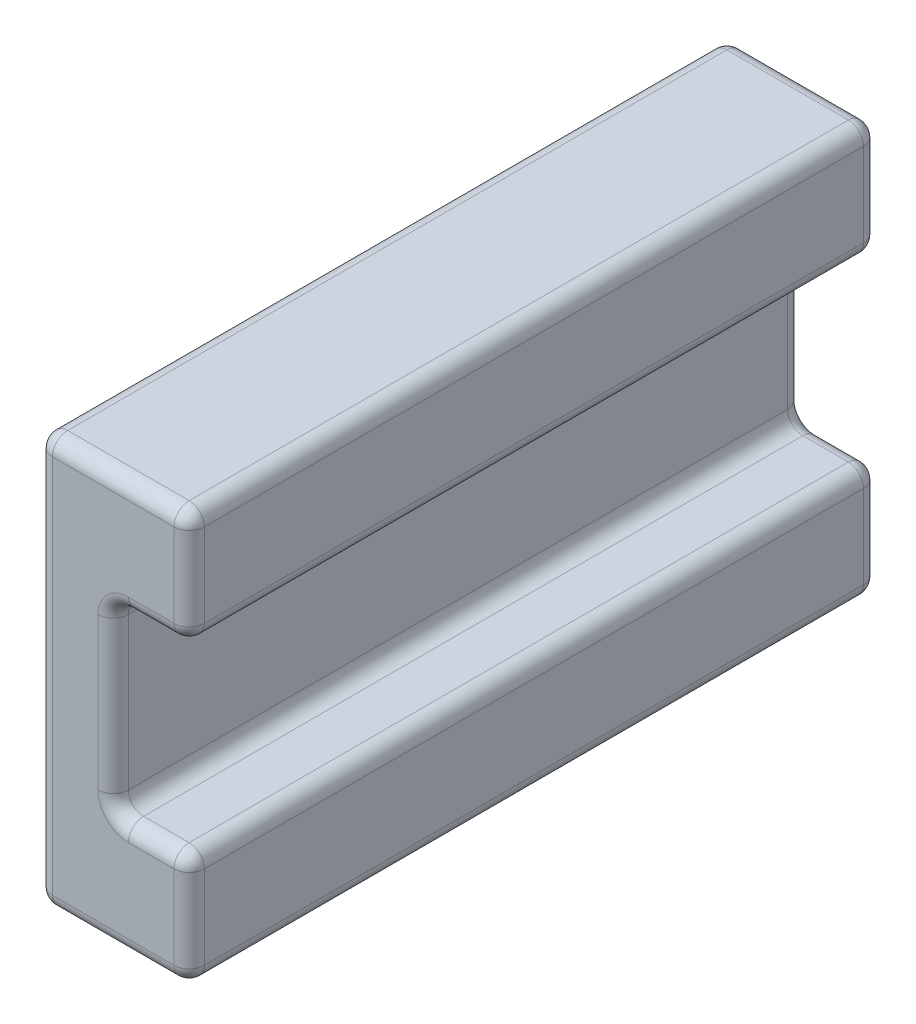
from build123d import *

# Parameters (mm, degrees)
BOSS_EXTRUDE1_DEPTH         = 45.4
FILLET1_R                   = 1
M3_TAPPED_HOLE2_D           = 2.5
M3_TAPPED_HOLE2_DEPTH       = 4.248924226
M3_TAPPED_HOLE2_CSINK_D     = 3.05
M3_TAPPED_HOLE2_CSINK_ANGLE = 90
M3_TAPPED_HOLE2_TIP         = 0.751075774


with BuildPart() as part:
    # Sketch1 → Boss-Extrude1 (new body)
    with BuildSketch(Plane.XY):
        Polygon((5, -6), (5, -13.5), (-5, -13.5), (-5, 13.5), (5, 13.5), (5, 6), (0, 6), (0, -6), align=None)
    extrude(amount=BOSS_EXTRUDE1_DEPTH)

    # Fillet1
    fillet1_edges = [part.edges().sort_by_distance(p)[0] for p in [
        (0, 0, 0),
        (2.5, -6, 0),
        (5, -9.75, 0),
        (0, -13.5, 0),
        (2.5, -6, 45.4),
        (-5, -13.5, 22.7),
        (-5, 13.5, 22.7),
        (5, 13.5, 22.7),
        (5, 6, 22.7),
        (0, 6, 22.7),
        (0, -6, 22.7),
        (5, -6, 22.7),
        (5, -13.5, 22.7),
        (0, 0, 45.4),
        (2.5, 6, 45.4),
        (5, 9.75, 45.4),
        (0, 13.5, 45.4),
        (-5, 0, 45.4),
        (0, -13.5, 45.4),
        (-5, 0, 0),
        (5, -9.75, 45.4),
        (0, 13.5, 0),
        (5, 9.75, 0),
        (2.5, 6, 0),
    ]]
    fillet(fillet1_edges, radius=FILLET1_R)

    # M3 Tapped Hole2
    with Locations(Plane(origin=(-5, 10, 12.7), x_dir=(0, -1, 0), z_dir=(-1, 0, 0))):
        with Locations((0, 0), (0, 20), (20, 20), (20, 0)):
            CounterSinkHole(M3_TAPPED_HOLE2_D / 2, M3_TAPPED_HOLE2_CSINK_D / 2, depth=M3_TAPPED_HOLE2_DEPTH, counter_sink_angle=M3_TAPPED_HOLE2_CSINK_ANGLE)
            with Locations((0, 0, -(M3_TAPPED_HOLE2_DEPTH + M3_TAPPED_HOLE2_TIP / 2))):  # 118° drill point
                Cone(0, M3_TAPPED_HOLE2_D / 2, M3_TAPPED_HOLE2_TIP, mode=Mode.SUBTRACT)


solid = part.part
